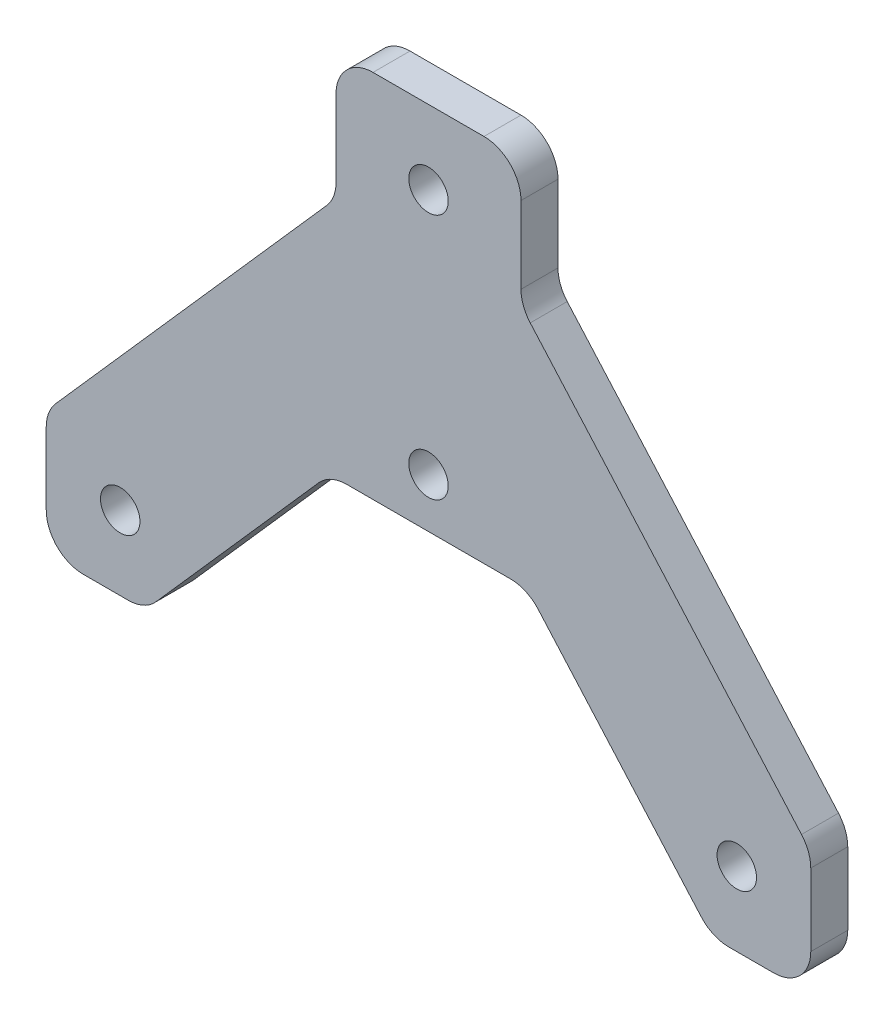
from build123d import *

# Parameters (mm, degrees)
SKETCH_1_R      = 1.6
EXTRUDE_1_DEPTH = 3
FILLET_1_R      = 3


with BuildPart() as part:
    # 草图1 → 凸台-拉伸1 (new body)
    with BuildSketch(Plane.XY):
        Polygon((8, 11), (-8, 11), (-23, -6), (-31, -6), (-31, 4), (-7.5, 30.633333333), (-7.5, 41), (7.5, 41), (7.5, 30.633333333), (31, 4), (31, -6), (23, -6), align=None)
        with Locations((-25, 0)):
            Circle(SKETCH_1_R, mode=Mode.SUBTRACT)
        with Locations((25, 0)):
            Circle(SKETCH_1_R, mode=Mode.SUBTRACT)
        with Locations((0, 35)):
            Circle(SKETCH_1_R, mode=Mode.SUBTRACT)
        with Locations((0, 15)):
            Circle(SKETCH_1_R, mode=Mode.SUBTRACT)
    extrude(amount=EXTRUDE_1_DEPTH)

    # 圆角1
    fillet_1_edges = [part.edges().sort_by_distance(p)[0] for p in [
        (23, -6, 1.5),
        (8, 11, 1.5),
        (-8, 11, 1.5),
        (-23, -6, 1.5),
        (-31, -6, 1.5),
        (-31, 4, 1.5),
        (-7.5, 30.633333333, 1.5),
        (-7.5, 41, 1.5),
        (7.5, 41, 1.5),
        (7.5, 30.633333333, 1.5),
        (31, 4, 1.5),
        (31, -6, 1.5),
    ]]
    fillet(fillet_1_edges, radius=FILLET_1_R)


solid = part.part
